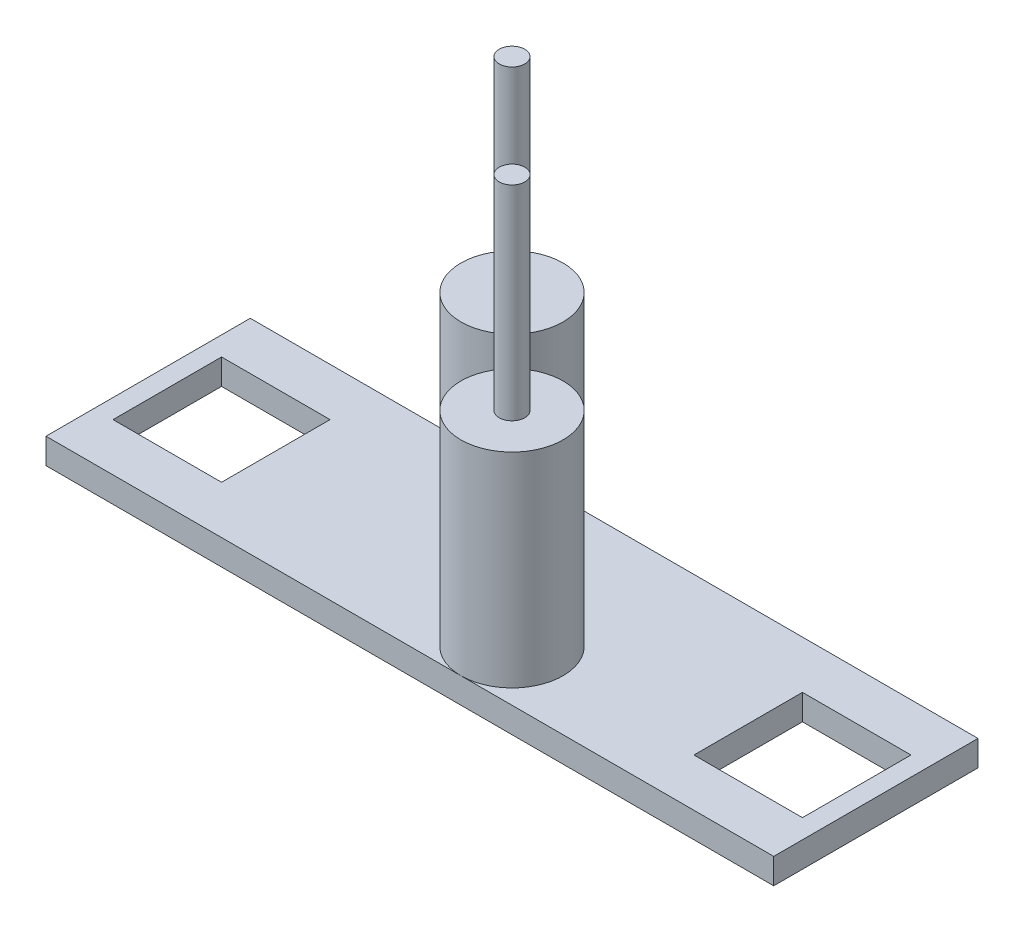
from build123d import *

# Parameters (mm, degrees)
SKETCH1_W           = 180.975
SKETCH1_H           = 50.8
SKETCH1_W_2         = 26.9875
SKETCH1_H_2         = 26.9875
BOSS_EXTRUDE1_DEPTH = 6.35
SKETCH3_R           = 3.175
BOSS_EXTRUDE2_DEPTH = 101.6
SKETCH4_R           = 12.7
BOSS_EXTRUDE3_DEPTH = 50.8


with BuildPart() as part:
    # Sketch1 → Boss-Extrude1 (new body)
    with BuildSketch(Plane(origin=(0, 0, 0), x_dir=(1, 0, 0), z_dir=(0, 1, 0))):
        with Locations((-90.4875, -25.4)):
            Rectangle(SKETCH1_W, SKETCH1_H)
        with Locations((-162.71875, -25.4)):
            Rectangle(SKETCH1_W_2, SKETCH1_H_2, mode=Mode.SUBTRACT)
        with Locations((-18.25625, -25.4)):
            Rectangle(SKETCH1_W_2, SKETCH1_H_2, mode=Mode.SUBTRACT)
    extrude(amount=BOSS_EXTRUDE1_DEPTH)

    # Sketch3 → Boss-Extrude2 (add)
    with BuildSketch(Plane(origin=(0, 6.35, 0), x_dir=(1, 0, 0), z_dir=(0, 1, 0))):
        with Locations(Location((-77.7875, -38.1, 0), (0, 0, 90))):
            Circle(SKETCH3_R)
        with Locations(Location((-103.1875, -12.7, 0), (0, 0, 90))):
            Circle(SKETCH3_R)
    extrude(amount=BOSS_EXTRUDE2_DEPTH)

    # Sketch4 → Boss-Extrude3 (add)
    with BuildSketch(Plane(origin=(0, 6.35, 0), x_dir=(1, 0, 0), z_dir=(0, 1, 0))):
        with Locations(Location((-103.1875, -12.7, 0), (0, 0, 90))):
            Circle(SKETCH4_R)
        with Locations(Location((-77.7875, -38.1, 0), (0, 0, 270))):
            Circle(SKETCH4_R)
    extrude(amount=BOSS_EXTRUDE3_DEPTH)


solid = part.part
